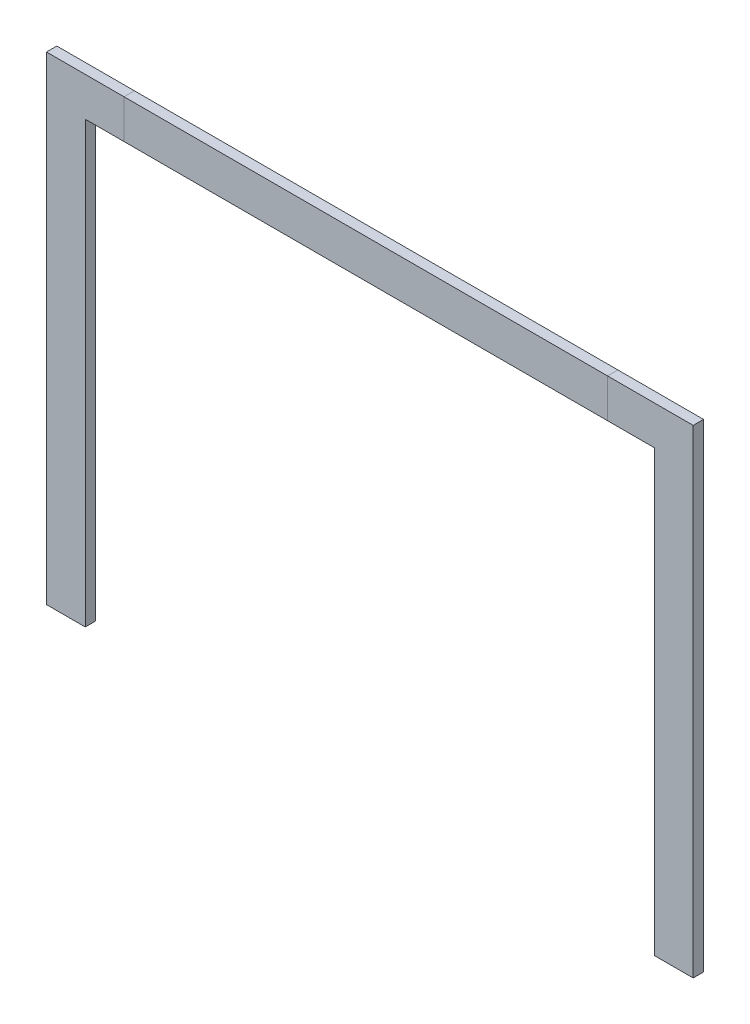
from build123d import *

# Parameters (mm, degrees)
SKETCH1_W           = 250
SKETCH1_H           = 185
BOSS_EXTRUDE1_DEPTH = 4
SKETCH2_W           = 186.887727078
SKETCH2_H           = 152.5
CUT_EXTRUDE2_DEPTH  = 10
SKETCH3_W           = 186.887727078
SKETCH3_H           = 32.5
BOSS_EXTRUDE2_DEPTH = 4
SKETCH4_W           = 186.887727078
SKETCH4_H           = 32.5
CUT_EXTRUDE3_DEPTH  = 4
SKETCH5_W           = 186.887727078
SKETCH5_H           = 30
BOSS_EXTRUDE3_DEPTH = 4
SKETCH6_W           = 220
SKETCH6_H           = 170
CUT_EXTRUDE5_DEPTH  = 4
SKETCH7_W           = 186.887727078
SKETCH7_H           = 15
CUT_EXTRUDE6_DEPTH  = 4


with BuildPart() as part:
    # Sketch1 → Boss-Extrude1 (new body)
    with BuildSketch(Plane.XY):
        Rectangle(SKETCH1_W, SKETCH1_H)
    extrude(amount=BOSS_EXTRUDE1_DEPTH)

    # Sketch2 → Cut-Extrude2 (cut)
    with BuildSketch(Plane(origin=(0, 0, 0), x_dir=(-1, 0, 0), z_dir=(0, 0, -1))):
        with Locations((1.556136461, -16.25)):
            Rectangle(SKETCH2_W, SKETCH2_H)
    extrude(amount=-CUT_EXTRUDE2_DEPTH, mode=Mode.SUBTRACT)

    # Sketch3 → Boss-Extrude2 (add)
    with BuildSketch(Plane.XY.offset(4)):
        with Locations((-1.556136461, -76.25)):
            Rectangle(SKETCH3_W, SKETCH3_H)
    extrude(amount=-BOSS_EXTRUDE2_DEPTH)

    # Sketch4 → Cut-Extrude3 (cut)
    with BuildSketch(Plane.XY.offset(4)):
        with Locations((-1.556136461, 76.25)):
            Rectangle(SKETCH4_W, SKETCH4_H)
    extrude(amount=-CUT_EXTRUDE3_DEPTH, mode=Mode.SUBTRACT)

    # Sketch6 → Cut-Extrude5 (cut)
    with BuildSketch(Plane.XY.offset(4)):
        with Locations((0, -7.5)):
            Rectangle(SKETCH6_W, SKETCH6_H)
    extrude(amount=-CUT_EXTRUDE5_DEPTH, mode=Mode.SUBTRACT)


with BuildPart() as body_2:
    # Sketch5 → Boss-Extrude3 (new body)
    with BuildSketch(Plane.XY.offset(4)):
        with Locations((-1.556136461, 77.5)):
            Rectangle(SKETCH5_W, SKETCH5_H)
    extrude(amount=-BOSS_EXTRUDE3_DEPTH)

    # Sketch7 → Cut-Extrude6 (cut)
    with BuildSketch(Plane.XY.offset(4)):
        with Locations((-1.556136461, 70)):
            Rectangle(SKETCH7_W, SKETCH7_H)
    extrude(amount=-CUT_EXTRUDE6_DEPTH, mode=Mode.SUBTRACT)


with BuildPart() as cut_extrude5_piece_1:
    # of the separate pieces the step leaves, piece 1, a body of its own (cut_extrude5_pieces)
    add(part.part.solids().sort_by_distance((110, -92.5, 0))[0])


with BuildPart() as cut_extrude5_piece_2:
    # of the separate pieces the step leaves, piece 2, a body of its own (cut_extrude5_pieces)
    add(part.part.solids().sort_by_distance((-125, -92.5, 0))[0])


solid = Compound([body_2.part, cut_extrude5_piece_1.part, cut_extrude5_piece_2.part])
